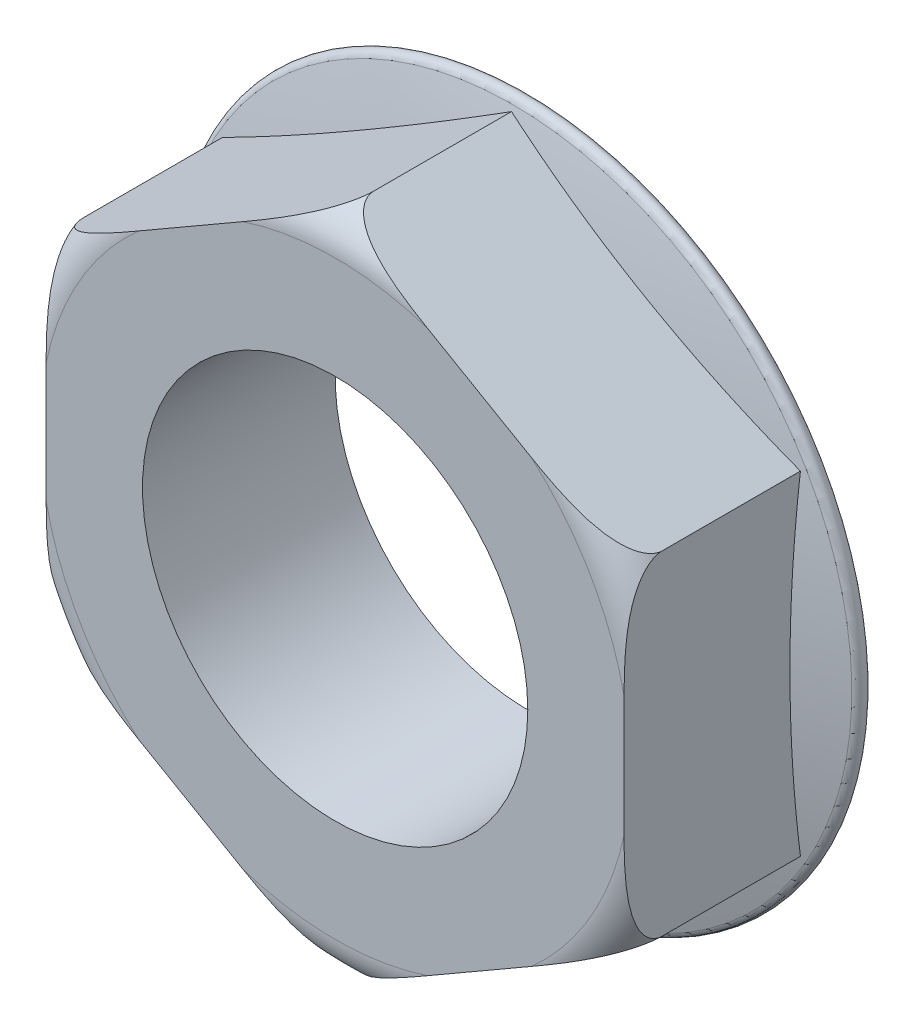
from build123d import *

# Parameters (mm, degrees)
HEAD_DEPTH         = 12.7
HOLE_SKETCH_R      = 12.7
THROUGH_HOLE_DEPTH = 35.556349042


with BuildPart() as part:
    # Head Sketch → Head (new body)
    with BuildSketch(Plane.XY):
        Polygon((0, 21.997045256), (19.05, 10.998522628), (19.05, -10.998522628), (0, -21.997045256), (-19.05, -10.998522628), (-19.05, 10.998522628), align=None)
    extrude(amount=HEAD_DEPTH)

    # Flange Sketch → Flange (revolve)
    with BuildSketch(Plane(origin=(0, 0, 0), x_dir=(-1, 0, 0), z_dir=(0, 1, 0)), mode=Mode.PRIVATE) as flange_sk:
        with BuildLine():
            Line((-22.225, 0), (0, 0))
            Line((0, 0), (0, 3.81))
            ThreePointArc((0, 3.81), (-11.263685666, 3.100765629), (-22.349444869, 0.984265913))
            ThreePointArc((-22.349444869, 0.984265913), (-22.721050883, 0.437282206), (-22.225, 0))
        make_face()
    revolve(flange_sk.sketch.rotate(Axis((0, 0, 1.843425858), (0, 0, 1)), 30), axis=Axis((0, 0, 1.843425858), (0, 0, 1)))

    # Sketch5 → Head Trim (revolve, cut)
    with BuildSketch(Plane(origin=(0, 0, 0), x_dir=(0, 0, -1), z_dir=(1, 0, 0)), mode=Mode.PRIVATE) as head_trim_sk:
        with BuildLine():
            Line((-12.7, -19.457045256), (-12.7, -21.997045256))
            Line((-12.7, -21.997045256), (-10.16, -21.997045256))
            ThreePointArc((-10.16, -21.997045256), (-11.956051224, -21.25309648), (-12.7, -19.457045256))
        make_face()
    revolve(head_trim_sk.sketch.rotate(Axis((0, 0, 15.085599173), (0, 0, -1)), 90), axis=Axis((0, 0, 15.085599173), (0, 0, -1)), mode=Mode.SUBTRACT)

    # Hole Sketch → Through Hole (cut, through all)
    with BuildSketch(Plane.XY.offset(12.7)):
        Circle(HOLE_SKETCH_R)
    extrude(amount=-THROUGH_HOLE_DEPTH, mode=Mode.SUBTRACT)


solid = part.part
